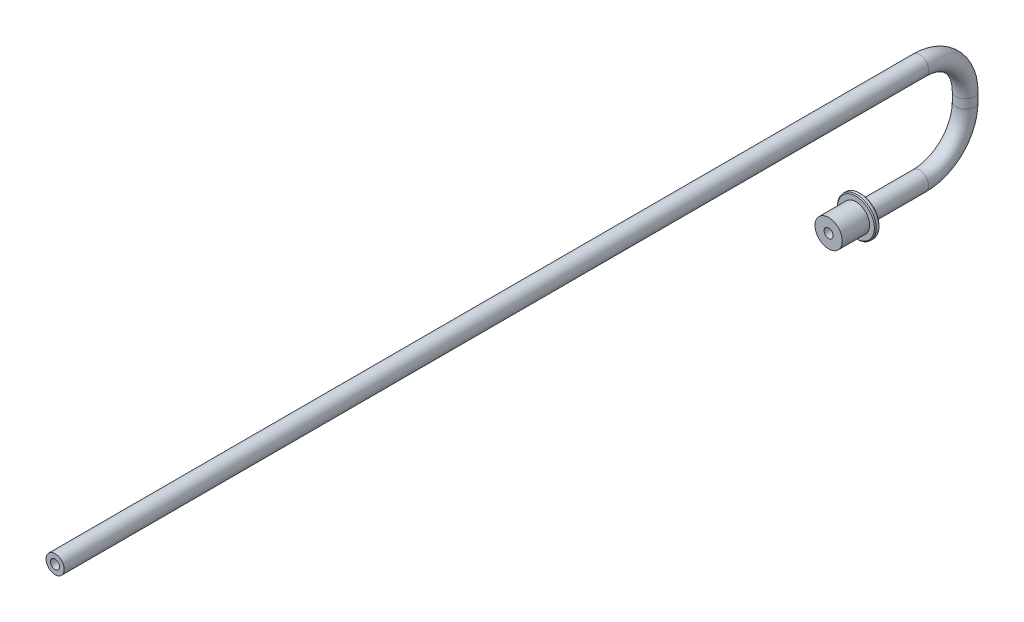
from build123d import *

# Parameters (mm, degrees)
SKETCH1_R           = 4.25
BOSS_EXTRUDE1_DEPTH = 1
SKETCH2_R           = 3
BOSS_EXTRUDE2_DEPTH = 6
SKETCH3_R           = 2
CUT_EXTRUDE1_DEPTH  = 10.226321044
CHAMFER1_SIZE       = 0.2
SKETCH4_R           = 2
SKETCH4_R_2         = 1


with BuildPart() as part:
    # Sketch1 → Boss-Extrude1 (new body)
    with BuildSketch(Plane.XY):
        Circle(SKETCH1_R)
    extrude(amount=BOSS_EXTRUDE1_DEPTH)

    # Sketch2 → Boss-Extrude2 (add)
    with BuildSketch(Plane.XY.offset(1)):
        Circle(SKETCH2_R)
    extrude(amount=BOSS_EXTRUDE2_DEPTH)

    # Sketch3 → Cut-Extrude1 (cut, through all)
    with BuildSketch(Plane(origin=(0, 0, 0), x_dir=(-1, 0, 0), z_dir=(0, 0, -1))):
        Circle(SKETCH3_R)
    extrude(amount=-CUT_EXTRUDE1_DEPTH, mode=Mode.SUBTRACT)

    # Chamfer1
    chamfer1_edges = [part.edges().sort_by_distance(p)[0] for p in [
        (2, 0, 0),
        (-4.25, 0, 0),
        (-4.25, 0, 1),
    ]]
    chamfer(chamfer1_edges, length=CHAMFER1_SIZE)

    # Sweep1: sweep along a path in Sketch5
    with BuildLine(Plane(origin=(0, 0, 0), x_dir=(0, 0, -1), z_dir=(1, 0, 0))) as sweep1_path:
        Line((-7, 0), (13, 0))
        ThreePointArc((13, 0), (20.071067812, 2.928932188), (23, 10))
        Line((23, 10), (23, 12))
        ThreePointArc((23, 12), (20.071067812, 19.071067812), (13, 22))
        Line((13, 22), (-177, 22))
    # Sketch4 → Sweep1 (sweep)
    with BuildSketch(Plane.XY.offset(7)):
        Circle(SKETCH4_R)
        Circle(SKETCH4_R_2, mode=Mode.SUBTRACT)
    sweep(path=sweep1_path.line)


solid = part.part
